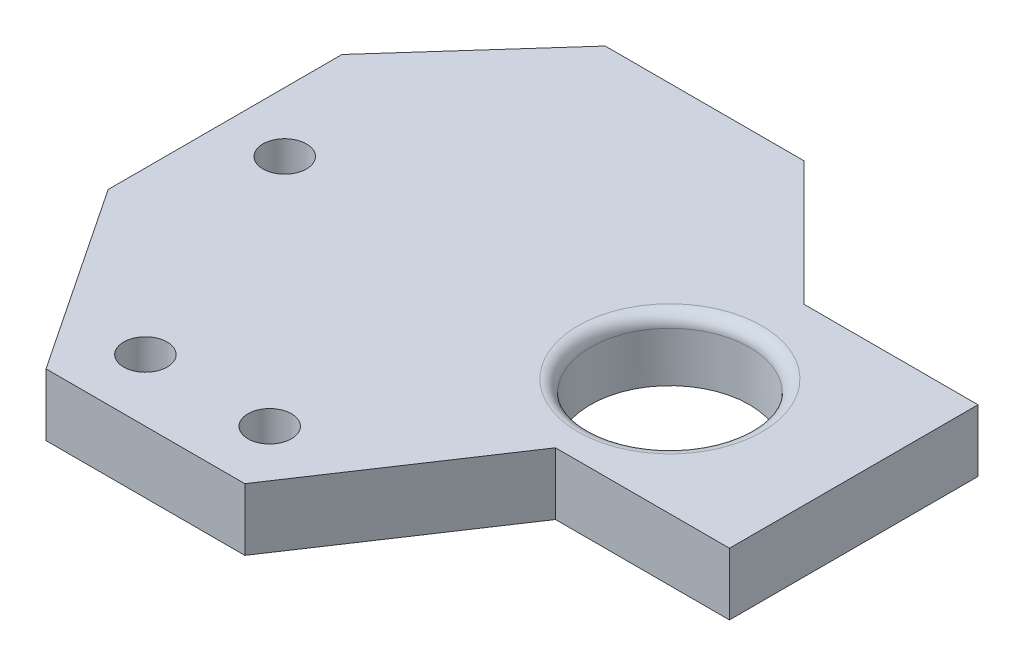
from build123d import *

# Parameters (mm, degrees)
SKETCH1_R           = 1.75
BOSS_EXTRUDE1_DEPTH = 5
SKETCH2_R           = 1.75
SKETCH2_R_2         = 6.4
CUT_EXTRUDE1_DEPTH  = 10
FILLET1_R           = 1


with BuildPart() as part:
    # Sketch1 → Boss-Extrude1 (new body)
    # profile 1 of 4: a face of its own
    with BuildSketch(Plane(origin=(0, 0, 0), x_dir=(1, 0, 0), z_dir=(0, 1, 0))):
        Polygon((50, 25), (0, 25), (0, 15), (10, 0), (26, 0), (36, 15), (50, 15), align=None)
        with Locations(Location((13, 5, 0), (0, 0, 270))):
            Circle(SKETCH1_R, mode=Mode.SUBTRACT)
        with Locations(Location((23, 5, 0), (0, 0, 270))):
            Circle(SKETCH1_R, mode=Mode.SUBTRACT)
    # profile 2 of 4: a face of its own
    with BuildSketch(Plane(origin=(0, 0, 0), x_dir=(1, 0, 0), z_dir=(0, 1, 0))):
        Polygon((10, 45), (0, 33.819660113), (0, 25), (50, 25), (50, 35), (36, 35), (26, 45), align=None)
    # profile 3 of 4: a face of its own
    with BuildSketch(Plane(origin=(0, 0, 0), x_dir=(1, 0, 0), z_dir=(0, 1, 0))):
        Polygon((10, 45), (0, 33.819660113), (0, 25), (50, 25), (50, 35), (36, 35), (26, 45), align=None)
    # profile 4 of 4: a face of its own
    with BuildSketch(Plane(origin=(0, 0, 0), x_dir=(1, 0, 0), z_dir=(0, 1, 0))):
        Polygon((10, 45), (0, 33.819660113), (0, 25), (50, 25), (50, 35), (36, 35), (26, 45), align=None)
    extrude(amount=BOSS_EXTRUDE1_DEPTH)

    # Sketch2 → Cut-Extrude1 (cut)
    with BuildSketch(Plane(origin=(0, 0, 0), x_dir=(-1, 0, 0), z_dir=(0, -1, 0))):
        with Locations(Location((-4.8, 24.409830056, 0), (0, 0, 90))):
            Circle(SKETCH2_R)
        with Locations(Location((-35.8, 24.409830056, 0), (0, 0, 90))):
            Circle(SKETCH2_R_2)
    extrude(amount=-CUT_EXTRUDE1_DEPTH, mode=Mode.SUBTRACT)

    # Fillet1
    fillet1_edges = [part.edges().sort_by_distance(p)[0] for p in [
        (35.8, 5, -18.009830056),
    ]]
    fillet(fillet1_edges, radius=FILLET1_R)


solid = part.part
